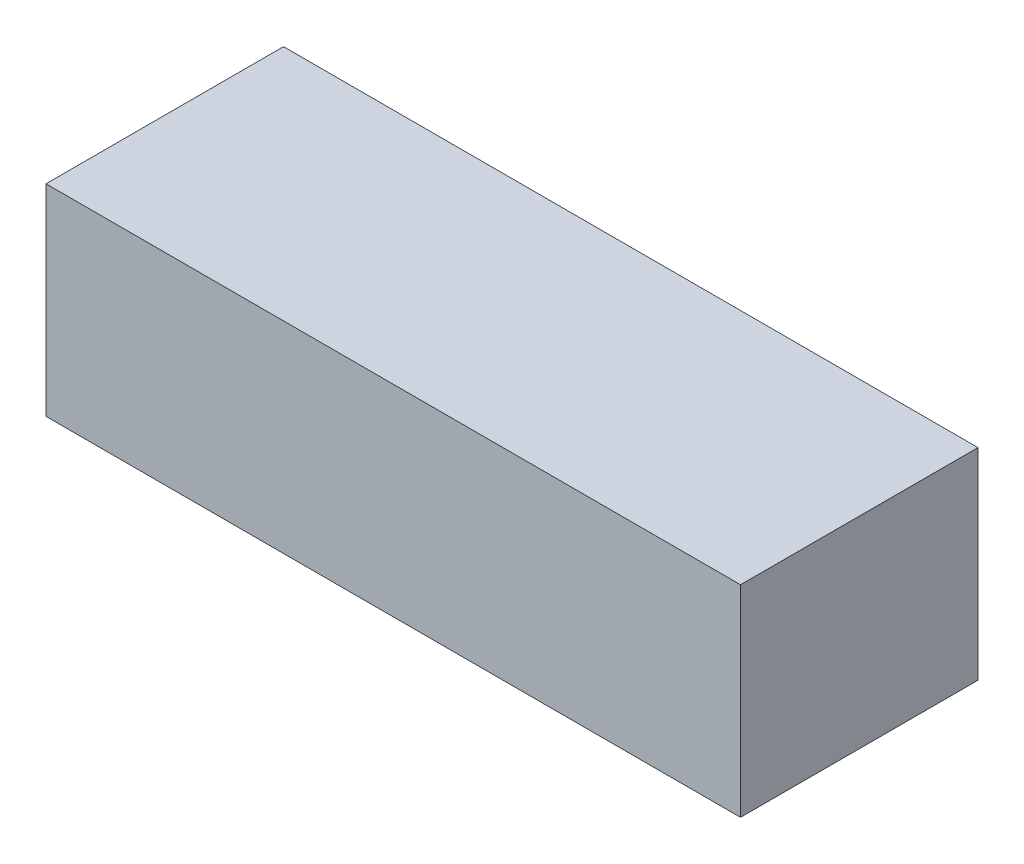
from build123d import *

# Parameters (mm, degrees)
SKETCH_1_W      = 65.5
SKETCH_1_H      = 22.4
EXTRUDE_1_DEPTH = 19


with BuildPart() as part:
    # 草圖1 → 填料-伸長1 (new body)
    with BuildSketch(Plane(origin=(0, 0, 0), x_dir=(1, 0, 0), z_dir=(0, 1, 0))):
        Rectangle(SKETCH_1_W, SKETCH_1_H)
    extrude(amount=EXTRUDE_1_DEPTH)


solid = part.part
